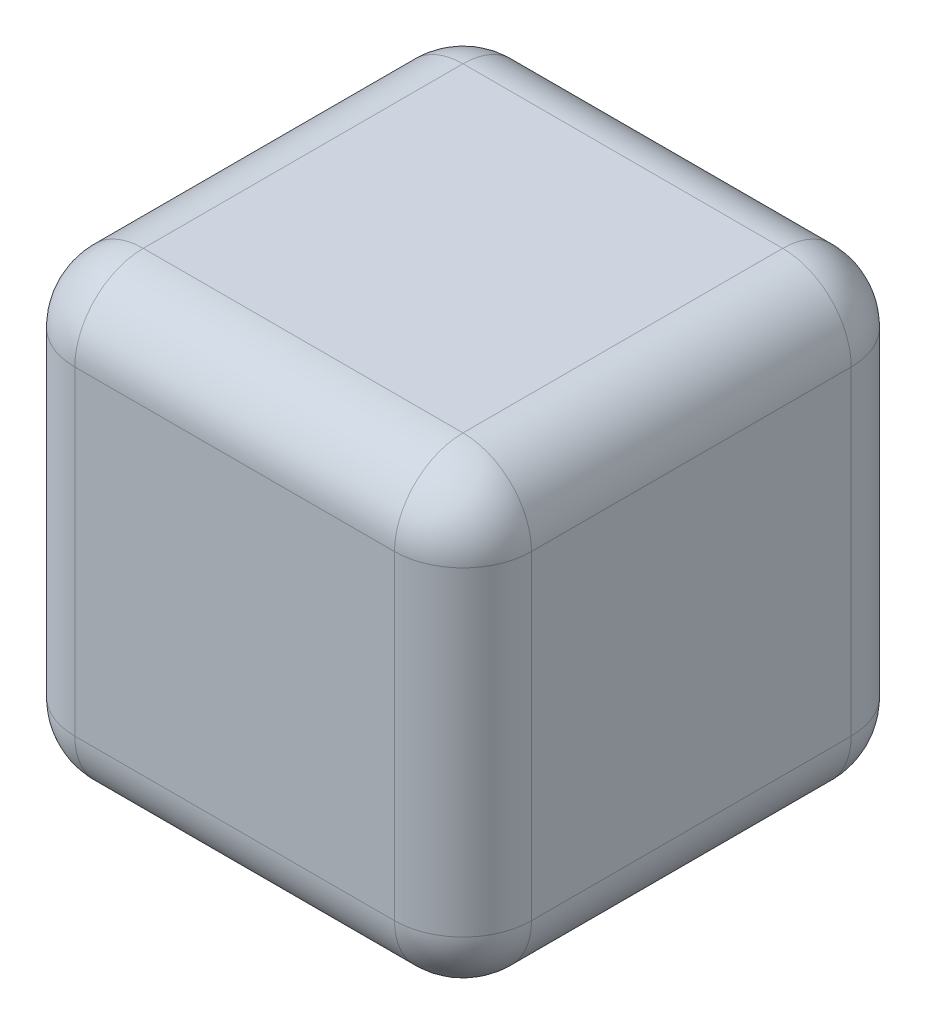
from build123d import *

# Parameters (mm, degrees)
SKETCH1_W           = 100
SKETCH1_H           = 100
BOSS_EXTRUDE1_DEPTH = 50
FILLET1_R           = 15


with BuildPart() as part:
    # Sketch1 → Boss-Extrude1 (new, symmetric)
    with BuildSketch(Plane.XY):
        Rectangle(SKETCH1_W, SKETCH1_H)
    extrude(amount=BOSS_EXTRUDE1_DEPTH, both=True)

    # Fillet1
    fillet1_edges = [part.edges().sort_by_distance(p)[0] for p in [
        (-50, 0, 50),
        (0, -50, 50),
        (50, 0, 50),
        (0, -50, -50),
        (-50, 0, -50),
        (0, 50, -50),
        (50, 0, -50),
        (50, -50, 0),
        (-50, -50, 0),
        (-50, 50, 0),
        (50, 50, 0),
        (0, 50, 50),
    ]]
    fillet(fillet1_edges, radius=FILLET1_R)


solid = part.part
